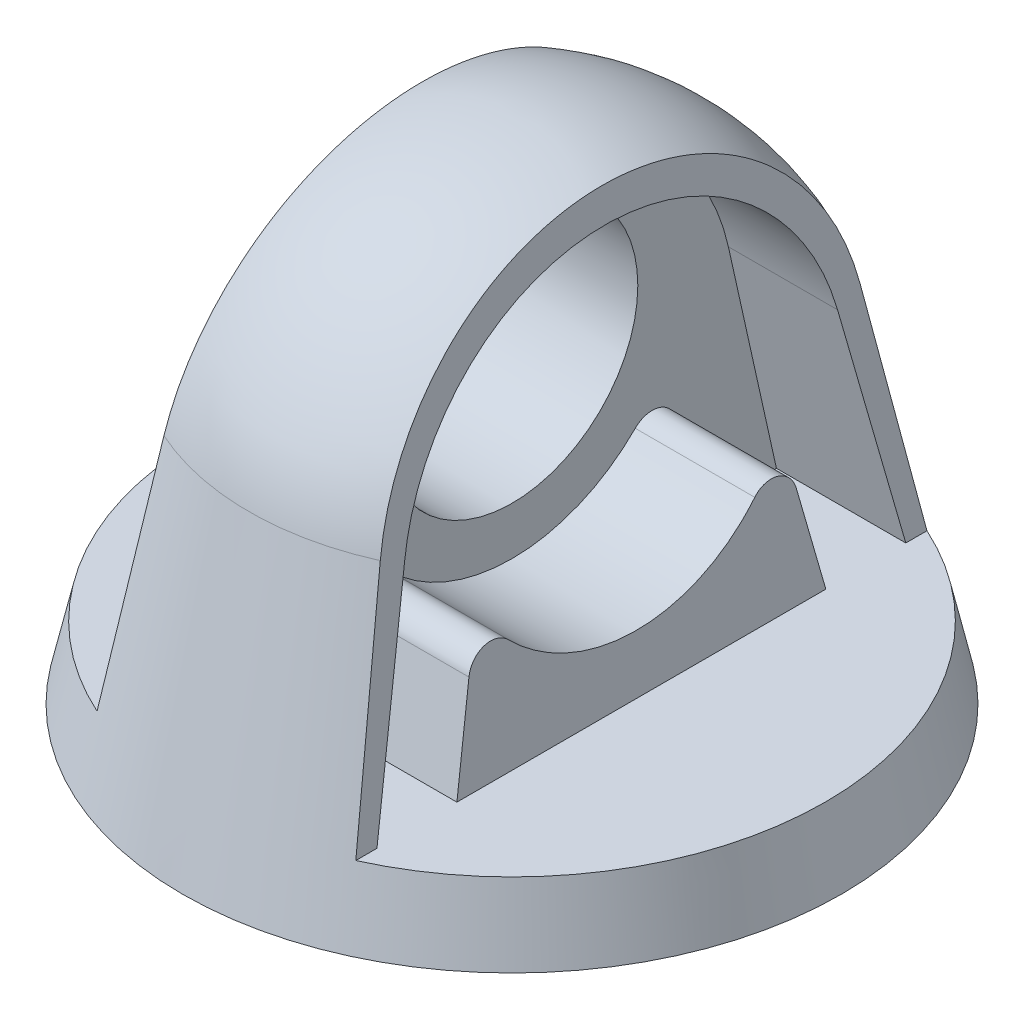
from build123d import *

# Parameters (mm, degrees)
CUT_EXTRUDE1_DEPTH      = 116.21718621802913
CUT_EXTRUDE4_DEPTH      = 116.21718621802913
CUT_EXTRUDE4_DEPTH_BACK = 35.99999999999998
SKETCH7_R               = 21
CUT_EXTRUDE7_DEPTH      = 116.21718621802913


with BuildPart() as part:
    # Sketch2 → Revolve3 (revolve)
    with BuildSketch(Plane.XY):
        with BuildLine():
            Line((0, 0), (-55, 0))
            Line((-55, 0), (-43.92591378263139, 49.77313145111816))
            ThreePointArc((-43.92591378263139, 49.77313145111816), (-28.153233248595832, 75.10549042030546), (0, 85))
            Line((0, 85), (0, 0))
        make_face()
    revolve(axis=Axis((0, 85, 0), (0, -1, 0)))

    # Sketch6 → Cut-Extrude1 (cut, symmetric)
    with BuildSketch(Plane.XY):
        with BuildLine():
            Line((-321.9355859945814, 12.000000000000119), (-52.33010500376227, 12.000000000000004))
            Line((-52.33010500376227, 12.000000000000004), (-23.212875062029127, 11.999999999999991))
            Line((-23.212875062029127, 11.999999999999991), (-15, 82.42640687119287))
            ThreePointArc((-15, 82.42640687119287), (2.76e-15, 84.99999999999994), (15, 82.42640687119287))
            Line((15, 82.42640687119287), (21.593288148671103, 11.999999999999996))
            Line((21.593288148671103, 11.999999999999996), (52.330105003762284, 12.000000000000016))
            Line((52.330105003762284, 12.000000000000016), (321.9355859945814, 12.000000000000187))
            Line((321.9355859945814, 12.000000000000187), (321.93558599458134, 551.2109619816384))
            Line((321.93558599458134, 551.2109619816384), (-321.93558599458146, 551.2109619816383))
            Line((-321.93558599458146, 551.2109619816383), (-321.9355859945814, 12.000000000000119))
        make_face()
    cut_extrude1 = extrude(amount=CUT_EXTRUDE1_DEPTH, both=True, mode=Mode.SUBTRACT)

    # Sketch7 → Cut-Extrude4 (cut, two sides: drawn at the far end of the back side and taken through both)
    with BuildSketch(Plane(origin=(0, 0, 0), x_dir=(0, 0, -1), z_dir=(1, 0, 0)).offset(-CUT_EXTRUDE4_DEPTH_BACK)):
        with Locations((0, 50)):
            Circle(SKETCH7_R)
    extrude(amount=CUT_EXTRUDE4_DEPTH + CUT_EXTRUDE4_DEPTH_BACK, mode=Mode.SUBTRACT)

    # Sketch7<10> → Cut-Extrude7 (cut, through all)
    with BuildSketch(Plane(origin=(0, 0, 0), x_dir=(0, 0, -1), z_dir=(1, 0, 0))):
        with BuildLine():
            Line((30.789792632377843, 11.999999999999996), (44.134487223755, 11.999999999999996))
            Line((44.134487223754995, 11.999999999999993), (36.11686244349691, 48.03568585980827))
            ThreePointArc((36.11686244349691, 48.03568585980827), (1.155e-14, 77), (-36.116862443496906, 48.03568585980828))
            Line((-36.116862443496906, 48.035685859808275), (-44.134487223754995, 11.999999999999993))
            Line((-44.134487223755, 11.999999999999993), (-30.78979263237784, 11.999999999999993))
            Line((-30.789792632377836, 11.999999999999982), (-27.316320113753125, 27.61172640955241))
            ThreePointArc((-27.316320113753125, 27.61172640955241), (-24.523281700699563, 30.58547626553829), (-20.57400117822397, 29.562033478879588))
            ThreePointArc((-20.57400117822397, 29.562033478879588), (5.33e-15, 21), (20.57400117822397, 29.562033478879595))
            ThreePointArc((20.574001178223973, 29.562033478879595), (24.523281700699563, 30.585476265538293), (27.31632011375313, 27.611726409552414))
            Line((27.31632011375313, 27.611726409552414), (30.789792632377843, 11.99999999999999))
        make_face()
    extrude(amount=CUT_EXTRUDE7_DEPTH, mode=Mode.SUBTRACT)

    # Mirror1: Cut-Extrude1 across plane
    add(cut_extrude1.mirror(Plane(origin=(0, 0, 0), x_dir=(0, 0, 1), z_dir=(1, 0, 0))), mode=Mode.SUBTRACT)


solid = part.part
